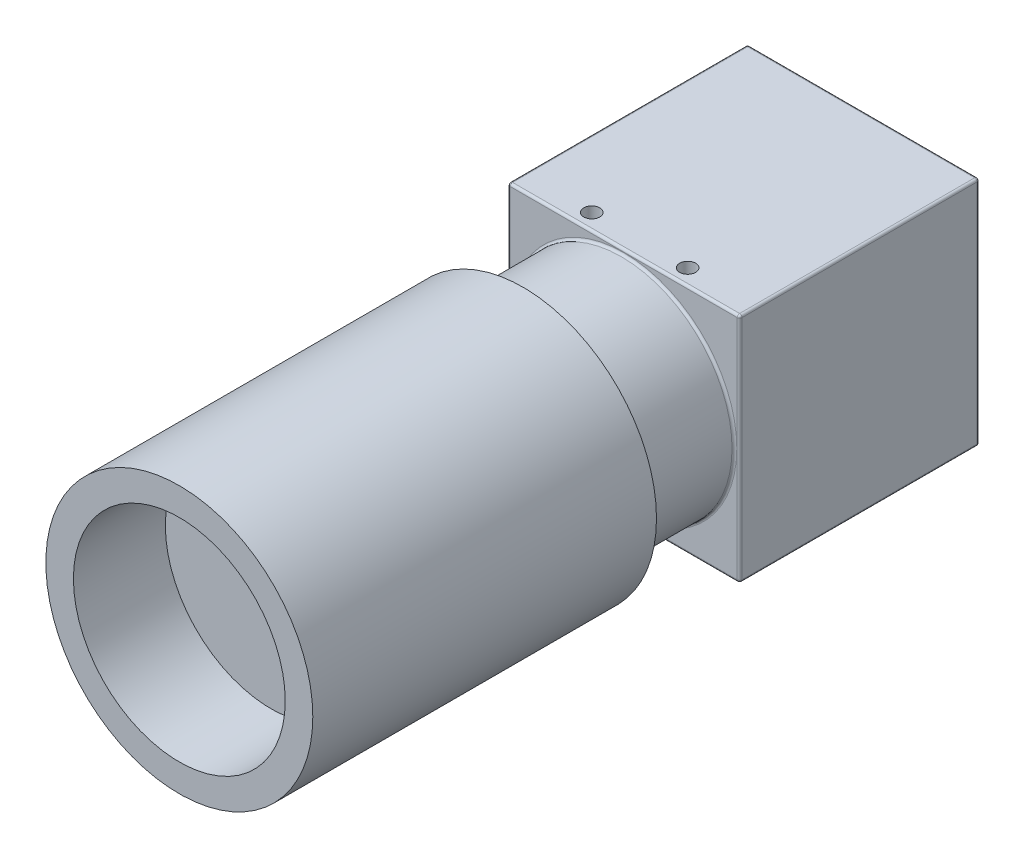
from build123d import *

# Parameters (mm, degrees)
SKETCH1_W           = 29
SKETCH1_H           = 29
BOSS_EXTRUDE1_DEPTH = 30
SKETCH2_R           = 1
CUT_EXTRUDE1_DEPTH  = 2.5
SKETCH3_R           = 1.5
CUT_EXTRUDE2_DEPTH  = 2.8
SKETCH4_R           = 1.5
CUT_EXTRUDE3_DEPTH  = 2.5
SKETCH5_R           = 1
CUT_EXTRUDE4_DEPTH  = 2
SKETCH6_R           = 13.85
BOSS_EXTRUDE2_DEPTH = 12.6
SKETCH7_R           = 16.7
BOSS_EXTRUDE3_DEPTH = 43
FILLET1_R           = 0.3
SKETCH8_R           = 13.25
CUT_EXTRUDE5_DEPTH  = 11.5


with BuildPart() as part:
    # Sketch1 → Boss-Extrude1 (new body)
    with BuildSketch(Plane.XY):
        with Locations((14.5, 14.5)):
            Rectangle(SKETCH1_W, SKETCH1_H)
    extrude(amount=BOSS_EXTRUDE1_DEPTH)

    # Sketch2 → Cut-Extrude1 (cut)
    with BuildSketch(Plane(origin=(0, 29, 0), x_dir=(1, 0, 0), z_dir=(0, 1, 0))):
        with Locations(Location((8.5, -28, 0), (0, 0, 270))):
            Circle(SKETCH2_R)
        with Locations(Location((20.5, -28, 0), (0, 0, 90))):
            Circle(SKETCH2_R)
    extrude(amount=-CUT_EXTRUDE1_DEPTH, mode=Mode.SUBTRACT)

    # Sketch3 → Cut-Extrude2 (cut)
    with BuildSketch(Plane.XZ):
        with Locations(Location((24.5, 27, 0), (0, 0, 270))):
            Circle(SKETCH3_R)
        with Locations(Location((4.5, 27, 0), (0, 0, 90))):
            Circle(SKETCH3_R)
    extrude(amount=-CUT_EXTRUDE2_DEPTH, mode=Mode.SUBTRACT)

    # Sketch4 → Cut-Extrude3 (cut)
    with BuildSketch(Plane.XZ):
        with Locations(Location((14.5, 3.3, 0), (0, 0, 270))):
            Circle(SKETCH4_R)
    extrude(amount=-CUT_EXTRUDE3_DEPTH, mode=Mode.SUBTRACT)

    # Sketch5 → Cut-Extrude4 (cut)
    with BuildSketch(Plane.XZ):
        with Locations(Location((20.5, 25.3, 0), (0, 0, 270))):
            Circle(SKETCH5_R)
        with Locations(Location((20.5, 3.3, 0), (0, 0, 270))):
            Circle(SKETCH5_R)
        with Locations(Location((8.5, 3.3, 0), (0, 0, 90))):
            Circle(SKETCH5_R)
        with Locations(Location((8.5, 25.3, 0), (0, 0, 90))):
            Circle(SKETCH5_R)
    extrude(amount=-CUT_EXTRUDE4_DEPTH, mode=Mode.SUBTRACT)

    # Sketch6 → Boss-Extrude2 (add)
    with BuildSketch(Plane.XY.offset(30)):
        with Locations((14.5, 14.5)):
            Circle(SKETCH6_R)
    extrude(amount=BOSS_EXTRUDE2_DEPTH)

    # Sketch7 → Boss-Extrude3 (add)
    with BuildSketch(Plane.XY.offset(42.6)):
        with Locations((14.5, 14.5)):
            Circle(SKETCH7_R)
    extrude(amount=BOSS_EXTRUDE3_DEPTH)

    # Fillet1
    fillet1_edges = [part.edges().sort_by_distance(p)[0] for p in [
        (29, 14.5, 30),
        (14.5, 29, 30),
        (0, 14.5, 30),
        (14.5, 29, 0),
        (0.65, 14.5, 30),
        (29, 14.5, 0),
        (14.5, 0, 0),
        (0, 14.5, 0),
        (14.5, 0, 30),
        (0, 29, 15),
        (29, 29, 15),
        (29, 0, 15),
        (0, 0, 15),
    ]]
    fillet(fillet1_edges, radius=FILLET1_R)

    # Sketch8 → Cut-Extrude5 (cut)
    with BuildSketch(Plane.XY.offset(85.6)):
        with Locations((14.5, 14.5)):
            Circle(SKETCH8_R)
    extrude(amount=-CUT_EXTRUDE5_DEPTH, mode=Mode.SUBTRACT)


solid = part.part
